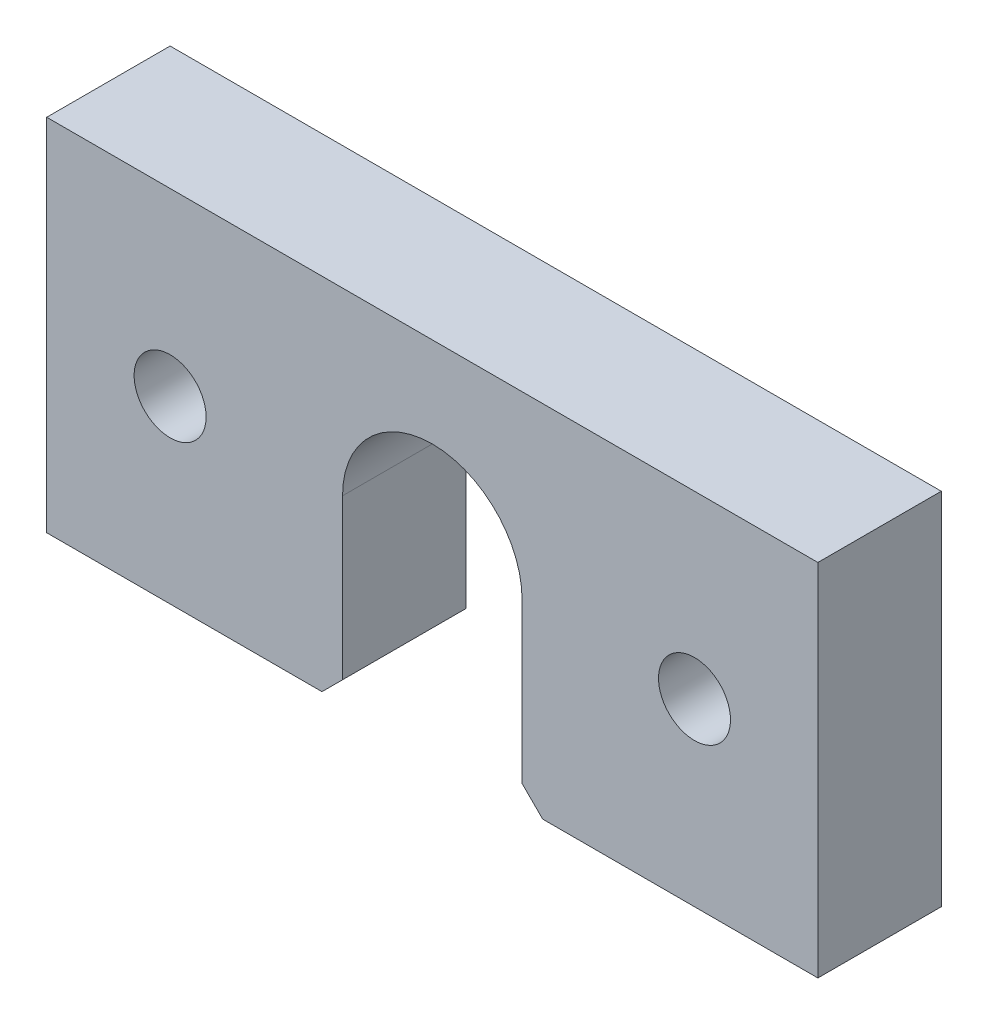
from build123d import *

# Parameters (mm, degrees)
SKETCH1_W             = 75
SKETCH1_H             = 35
BOSS_EXTRUDE1_DEPTH   = 12
CUT_EXTRUDE1_REACH    = 45.087
M8X1_0_TAPPED_HOLE1_D = 7
CHAMFER1_SIZE         = 2


with BuildPart() as part:
    # Sketch1 → Boss-Extrude1 (new body)
    with BuildSketch(Plane.XY):
        Rectangle(SKETCH1_W, SKETCH1_H)
    extrude(amount=BOSS_EXTRUDE1_DEPTH)

    # Sketch2 → Cut-Extrude1 (cut, up to next)
    with BuildSketch(Plane(origin=(0, 0, 0), x_dir=(-1, 0, 0), z_dir=(0, 0, -1)), mode=Mode.PRIVATE) as cut_extrude1_sk1:
        with BuildLine():
            Line((-8.73125, 0), (-8.73125, -17.5))
            Line((-8.73125, -17.5), (8.73125, -17.5))
            Line((8.73125, -17.5), (8.73125, 0))
            ThreePointArc((8.73125, 0), (0, 8.73125), (-8.73125, 0))
        make_face()
    cut_extrude1_tool1 = extrude(cut_extrude1_sk1.sketch, amount=-CUT_EXTRUDE1_REACH, mode=Mode.PRIVATE) & part.part
    add(cut_extrude1_tool1.solids().sort_by_distance((0, -5.243288, 0))[0], mode=Mode.SUBTRACT)

    # M8x1.0 Tapped Hole1 (through all)
    with Locations(Plane.XY.offset(12)):
        with Locations((-25.5, 0), (25.5, 0)):
            Hole(M8X1_0_TAPPED_HOLE1_D / 2)

    # Chamfer1
    chamfer1_edges = [part.edges().sort_by_distance(p)[0] for p in [
        (-8.73125, -17.5, 6),
        (8.73125, -17.5, 6),
    ]]
    chamfer(chamfer1_edges, length=CHAMFER1_SIZE)


solid = part.part
